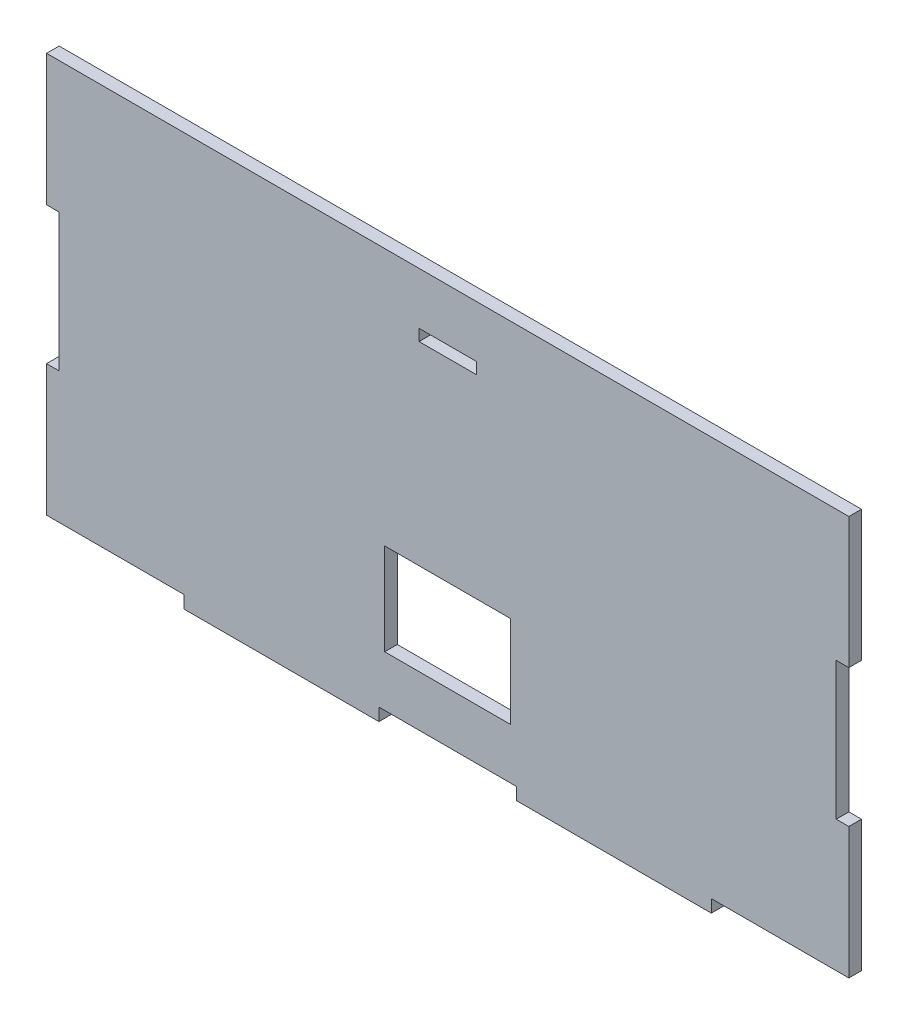
from build123d import *

# Parameters (mm, degrees)
CROQUIS2_W              = 55
CROQUIS2_H              = 40
CROQUIS2_W_2            = 25
CROQUIS2_H_2            = 5
SALIENTE_EXTRUIR3_DEPTH = 5.5


with BuildPart() as part:
    # Croquis2 → Saliente-Extruir3 (new body)
    with BuildSketch(Plane.XY):
        Polygon((-33.629487614, 28.380396003), (316.370482983, 28.380396003), (316.370482983, -28.726140479), (310.870482983, -28.726140479), (310.870482983, -88.726140479), (316.370482983, -88.726140479), (316.370482983, -145.976140479), (256.370512386, -145.976140479), (256.370512386, -151.476140479), (171.370512386, -151.476140479), (171.370512386, -146.119603997), (111.370512386, -146.119603997), (111.370512386, -151.619603997), (26.370512386, -151.619603997), (26.370512386, -146.119603997), (-33.629487614, -146.119603997), (-33.629487614, -88.869603997), (-28.129487614, -88.869603997), (-28.129487614, -28.869603997), (-33.629487614, -28.869603997), align=None)
        with Locations((141.370512386, -103.978010814)):
            Rectangle(CROQUIS2_W, CROQUIS2_H, mode=Mode.SUBTRACT)
        with Locations((141.370512386, 3.223658367)):
            Rectangle(CROQUIS2_W_2, CROQUIS2_H_2, mode=Mode.SUBTRACT)
    extrude(amount=SALIENTE_EXTRUIR3_DEPTH)


solid = part.part
